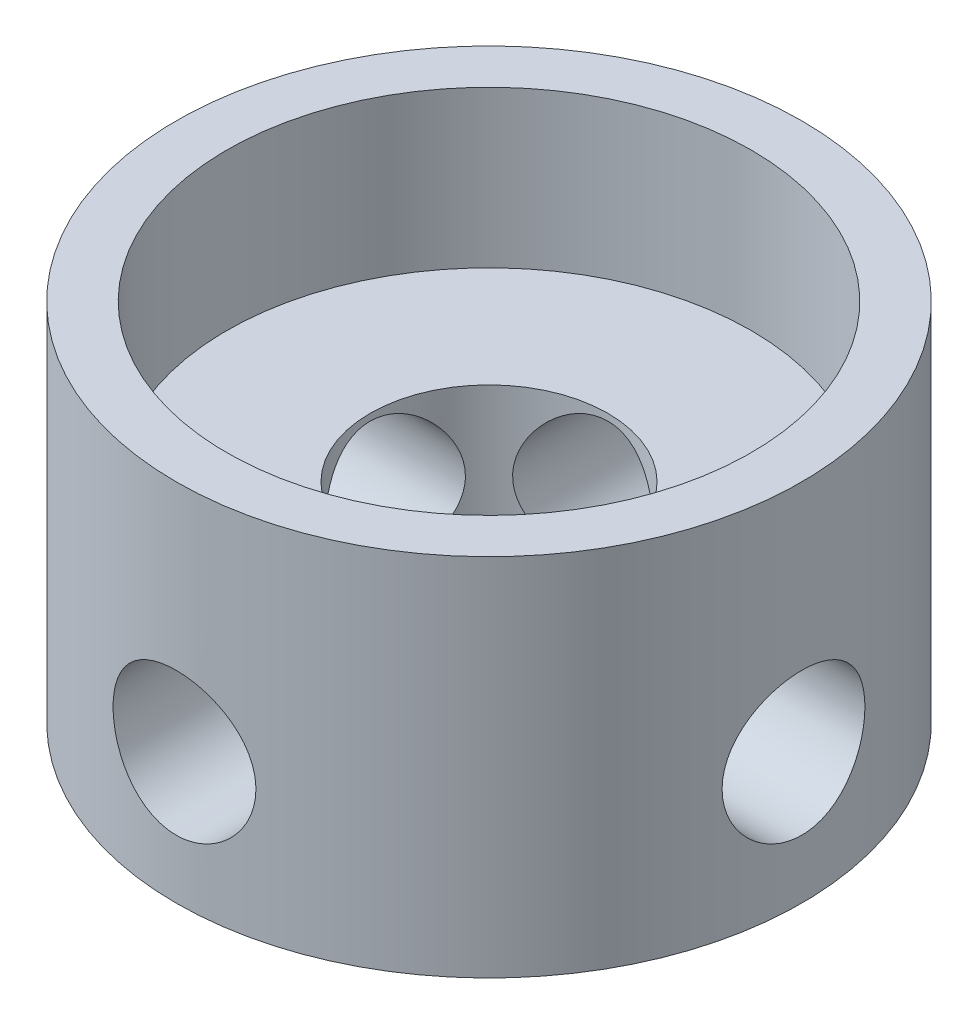
from build123d import *

# Parameters (mm, degrees)
SKETCH1_R           = 7.62
SKETCH1_R_2         = 2.8956
BOSS_EXTRUDE1_DEPTH = 5.08
SKETCH2_R           = 7.62
SKETCH2_R_2         = 6.3881
BOSS_EXTRUDE2_DEPTH = 3.81
SKETCH3_R           = 1.7399
CUT_EXTRUDE1_DEPTH  = 12.7
SKETCH4_R           = 1.7399
CUT_EXTRUDE2_DEPTH  = 12.7


with BuildPart() as part:
    # Sketch1 → Boss-Extrude1 (new body)
    with BuildSketch(Plane(origin=(0, 0, 0), x_dir=(1, 0, 0), z_dir=(0, 1, 0))):
        with Locations(Location((0, 0, 0), (0, 0, 270))):
            Circle(SKETCH1_R)
        with Locations(Location((0, 0, 0), (0, 0, 270))):
            Circle(SKETCH1_R_2, mode=Mode.SUBTRACT)
    extrude(amount=BOSS_EXTRUDE1_DEPTH)

    # Sketch2 → Boss-Extrude2 (add)
    with BuildSketch(Plane(origin=(0, 5.08, 0), x_dir=(1, 0, 0), z_dir=(0, 1, 0))):
        with Locations(Location((0, 0, 0), (0, 0, 270))):
            Circle(SKETCH2_R)
        with Locations(Location((0, 0, 0), (0, 0, 90))):
            Circle(SKETCH2_R_2, mode=Mode.SUBTRACT)
    extrude(amount=BOSS_EXTRUDE2_DEPTH)

    # Sketch3 → Cut-Extrude1 (cut, symmetric)
    with BuildSketch(Plane.XY):
        with Locations((0, 3.175)):
            Circle(SKETCH3_R)
    extrude(amount=CUT_EXTRUDE1_DEPTH, both=True, mode=Mode.SUBTRACT)

    # Sketch4 → Cut-Extrude2 (cut, symmetric)
    with BuildSketch(Plane(origin=(0, 0, 0), x_dir=(0, 0, -1), z_dir=(1, 0, 0))):
        with Locations((0, 3.175)):
            Circle(SKETCH4_R)
    extrude(amount=CUT_EXTRUDE2_DEPTH, both=True, mode=Mode.SUBTRACT)


solid = part.part
